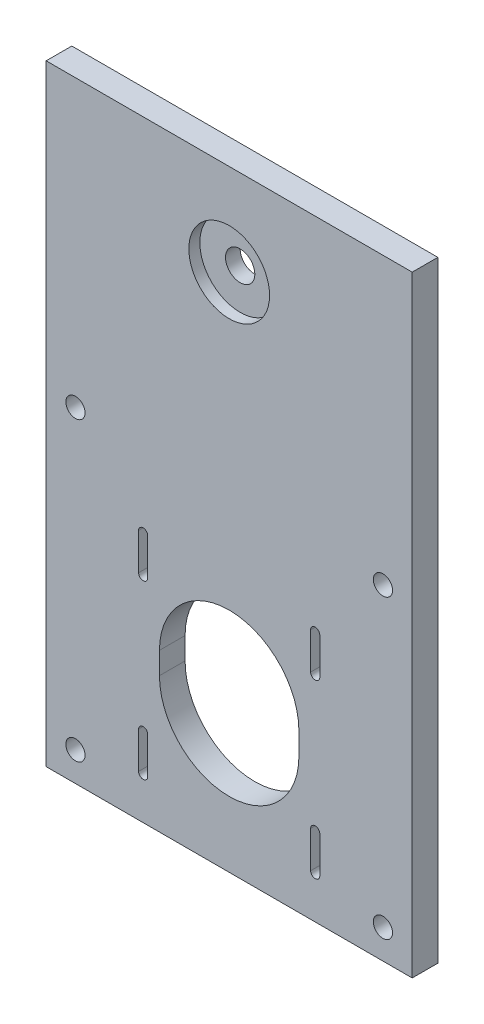
from build123d import *

# Parameters (mm, degrees)
SKETCH1_W           = 100
SKETCH1_H           = 247
SKETCH1_R           = 2.625
SKETCH1_R_2         = 4
BOSS_EXTRUDE1_DEPTH = 7
SKETCH2_R           = 11.025
CUT_EXTRUDE1_DEPTH  = 3
CUT_EXTRUDE2_DEPTH  = 3
SKETCH4_W           = 100
SKETCH4_H           = 80
CUT_EXTRUDE3_DEPTH  = 134.421325132


with BuildPart() as part:
    # Sketch1 → Boss-Extrude1 (new body)
    with BuildSketch(Plane.XY):
        Rectangle(SKETCH1_W, SKETCH1_H)
        with Locations((-42, -34.5)):
            Circle(SKETCH1_R, mode=Mode.SUBTRACT)
        with Locations((42, -34.5)):
            Circle(SKETCH1_R, mode=Mode.SUBTRACT)
        with Locations((-42, -115.5)):
            Circle(SKETCH1_R, mode=Mode.SUBTRACT)
        with Locations((42, -115.5)):
            Circle(SKETCH1_R, mode=Mode.SUBTRACT)
        with Locations((0, 18.5)):
            Circle(SKETCH1_R_2, mode=Mode.SUBTRACT)
        with Locations((42, 115.5)):
            Circle(SKETCH1_R, mode=Mode.SUBTRACT)
        with Locations((-42, 115.5)):
            Circle(SKETCH1_R, mode=Mode.SUBTRACT)
        with BuildLine():
            Line((-19.05, -80.5), (-19.05, -86.5))
            ThreePointArc((-19.05, -86.5), (0, -105.55), (19.05, -86.5))
            Line((19.05, -86.5), (19.05, -80.5))
            ThreePointArc((19.05, -80.5), (0, -61.45), (-19.05, -80.5))
        make_face(mode=Mode.SUBTRACT)
        with BuildLine():
            Line((-22.25, -55), (-22.25, -65))
            ThreePointArc((-22.25, -65), (-23.5, -66.25), (-24.75, -65))
            Line((-24.75, -65), (-24.75, -55))
            ThreePointArc((-24.75, -55), (-23.5, -53.75), (-22.25, -55))
        make_face(mode=Mode.SUBTRACT)
        with BuildLine():
            Line((22.25, -55), (22.25, -65))
            ThreePointArc((22.25, -65), (23.5, -66.25), (24.75, -65))
            Line((24.75, -65), (24.75, -55))
            ThreePointArc((24.75, -55), (23.5, -53.75), (22.25, -55))
        make_face(mode=Mode.SUBTRACT)
        with BuildLine():
            Line((22.25, -112), (22.25, -102))
            ThreePointArc((22.25, -102), (23.5, -100.75), (24.75, -102))
            Line((24.75, -102), (24.75, -112))
            ThreePointArc((24.75, -112), (23.5, -113.25), (22.25, -112))
        make_face(mode=Mode.SUBTRACT)
        with BuildLine():
            Line((-22.25, -112), (-22.25, -102))
            ThreePointArc((-22.25, -102), (-23.5, -100.75), (-24.75, -102))
            Line((-24.75, -102), (-24.75, -112))
            ThreePointArc((-24.75, -112), (-23.5, -113.25), (-22.25, -112))
        make_face(mode=Mode.SUBTRACT)
    extrude(amount=BOSS_EXTRUDE1_DEPTH)

    # Sketch2 → Cut-Extrude1 (cut)
    with BuildSketch(Plane.XY.offset(7)):
        with Locations((0, 18.5)):
            Circle(SKETCH2_R)
    extrude(amount=-CUT_EXTRUDE1_DEPTH, mode=Mode.SUBTRACT)

    # Sketch3 → Cut-Extrude2 (cut)
    with BuildSketch(Plane.XY):
        with BuildLine():
            Line((-26.5, -65), (-26.5, -55))
            ThreePointArc((-26.5, -55), (-23.5, -52), (-20.5, -55))
            Line((-20.5, -55), (-20.5, -65))
            ThreePointArc((-20.5, -65), (-23.5, -68), (-26.5, -65))
        make_face()
        with BuildLine():
            Line((20.5, -65), (20.5, -55))
            ThreePointArc((20.5, -55), (23.5, -52), (26.5, -55))
            Line((26.5, -55), (26.5, -65))
            ThreePointArc((26.5, -65), (23.5, -68), (20.5, -65))
        make_face()
        with BuildLine():
            Line((-26.5, -112), (-26.5, -102))
            ThreePointArc((-26.5, -102), (-23.5, -99), (-20.5, -102))
            Line((-20.5, -102), (-20.5, -112))
            ThreePointArc((-20.5, -112), (-23.5, -115), (-26.5, -112))
        make_face()
        with BuildLine():
            Line((20.5, -112), (20.5, -102))
            ThreePointArc((20.5, -102), (23.5, -99), (26.5, -102))
            Line((26.5, -102), (26.5, -112))
            ThreePointArc((26.5, -112), (23.5, -115), (20.5, -112))
        make_face()
    extrude(amount=CUT_EXTRUDE2_DEPTH, mode=Mode.SUBTRACT)

    # Sketch4 → Cut-Extrude3 (cut, through all)
    with BuildSketch(Plane.XY.offset(7)):
        with Locations((0, 83.5)):
            Rectangle(SKETCH4_W, SKETCH4_H)
    extrude(amount=-CUT_EXTRUDE3_DEPTH, mode=Mode.SUBTRACT)


solid = part.part
